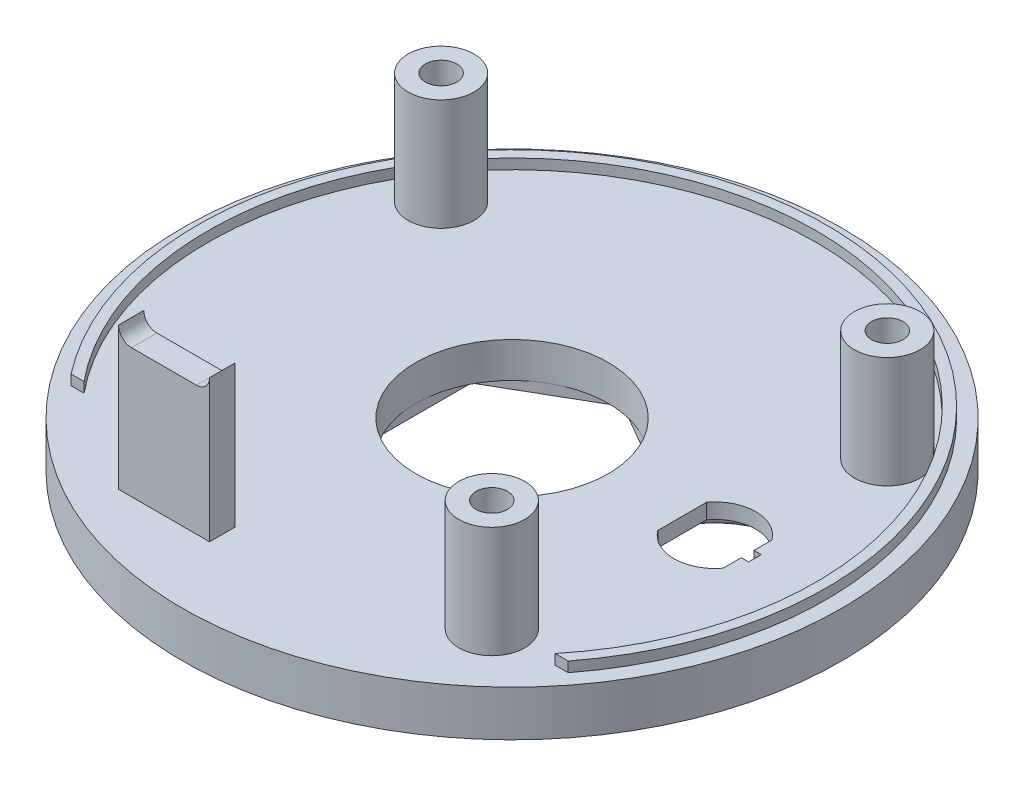
from build123d import *
from build123d.topology import SkipClean

# Parameters (mm, degrees)
SKETCH1_R           = 32.5
BOSS_EXTRUDE1_DEPTH = 21
SHELL1_T            = -2.5
CUT_EXTRUDE2_START  = -18.5
CUT_EXTRUDE2_DEPTH  = 18.5
BOSS_EXTRUDE2_DEPTH = 18.5
SKETCH9_R           = 3.25
BOSS_EXTRUDE3_DEPTH = 10.97
CUT_EXTRUDE4_START  = -18.5
CUT_EXTRUDE4_DEPTH  = 18.5
CUT_EXTRUDE5_DEPTH  = 70.707226983
BOSS_EXTRUDE4_DEPTH = 1
BOSS_EXTRUDE5_START = 2
SKETCH15_R          = 32.5
BOSS_EXTRUDE5_DEPTH = 2
SKETCH13_R          = 9.5
CUT_EXTRUDE6_DEPTH  = 49.052683588
CUT_EXTRUDE7_DEPTH  = 1
SKETCH18_R          = 7.5
CUT_EXTRUDE8_DEPTH  = 3
SKETCH21_R          = 3
CUT_EXTRUDE9_DEPTH  = 3
FILLET1_R           = 0.5
SKETCH23_R          = 1.55
CUT_EXTRUDE10_DEPTH = 49.51154914


with BuildPart() as part:
    # Sketch1 → Boss-Extrude1 (new body)
    with BuildSketch(Plane(origin=(0, 0, 0), x_dir=(1, 0, 0), z_dir=(0, 1, 0))):
        with Locations(Location((0, 0, 0), (0, 0, 90))):
            Circle(SKETCH1_R)
    extrude(amount=BOSS_EXTRUDE1_DEPTH)

    # Shell1
    shell1_openings = [part.faces().sort_by_distance(p)[0] for p in [
        (0, 21, 0),
    ]]
    offset(amount=SHELL1_T, openings=shell1_openings, kind=Kind.INTERSECTION)

    # Sketch4 → Cut-Extrude2 (cut)
    with BuildSketch(Plane(origin=(0, 21, 0), x_dir=(1, 0, 0), z_dir=(0, 1, 0)).offset(CUT_EXTRUDE2_START)):
        with BuildLine():
            Line((-19.2835, -22.981440942), (19.2835, -22.981440942))
            Line((19.2835, -22.981440942), (22.980499826, -22.981440942))
            ThreePointArc((22.980499826, -22.981440942), (0, -32.5), (-22.980499826, -22.981440942))
            Line((-22.980499826, -22.981440942), (-19.2835, -22.981440942))
        make_face()
    extrude(amount=CUT_EXTRUDE2_DEPTH, mode=Mode.SUBTRACT)

    # Sketch5 → Boss-Extrude2 (add, through all)
    with SkipClean():  # the faces are left unmerged after this step: merging them gives an invalid solid
        with BuildSketch(Plane(origin=(0, 2.5, 0), x_dir=(1, 0, 0), z_dir=(0, 1, 0))):
            with BuildLine():
                Line((-22.980499826, -22.981440942), (22.980499826, -22.981440942))
                ThreePointArc((22.980499826, -22.981440942), (21.612881002, -24.27206985), (20.17290677, -25.481440942))
                Line((20.17290677, -25.481440942), (-20.17290677, -25.481440942))
                ThreePointArc((-20.17290677, -25.481440942), (-21.612881002, -24.27206985), (-22.980499826, -22.981440942))
            make_face()
        extrude(amount=BOSS_EXTRUDE2_DEPTH)

    # Sketch9 → Boss-Extrude3 (add)
    with SkipClean():  # the faces are left unmerged after this step: merging them gives an invalid solid
        with BuildSketch(Plane(origin=(0, 2.5, 0), x_dir=(1, 0, 0), z_dir=(0, 1, 0))):
            with Locations(Location((-22, 15, 0), (0, 0, 90))):
                Circle(SKETCH9_R)
            with Locations(Location((22, 15, 0), (0, 0, 90))):
                Circle(SKETCH9_R)
            with Locations(Location((17, -19, 0), (0, 0, 90))):
                Circle(SKETCH9_R)
        extrude(amount=BOSS_EXTRUDE3_DEPTH)

    # Sketch10 → Cut-Extrude4 (cut)
    with BuildSketch(Plane(origin=(0, 21, 0), x_dir=(1, 0, 0), z_dir=(0, 1, 0)).offset(CUT_EXTRUDE4_START)):
        with BuildLine():
            Line((-20.17290677, -25.481440942), (-13.33, -25.481440942))
            Line((-13.33, -25.481440942), (-13.33, -22.981440942))
            Line((-13.33, -22.981440942), (-19.2835, -22.981440942))
            ThreePointArc((-19.2835, -22.981440942), (0, 30), (19.2835, -22.981440942))
            Line((19.2835, -22.981440942), (-4.35, -22.981440942))
            Line((-4.35, -22.981440942), (-4.35, -25.481440942))
            Line((-4.35, -25.481440942), (20.17290677, -25.481440942))
            ThreePointArc((20.17290677, -25.481440942), (0, 32.5), (-20.17290677, -25.481440942))
        make_face()
    extrude(amount=CUT_EXTRUDE4_DEPTH, mode=Mode.SUBTRACT)

    # Sketch11 → Cut-Extrude5 (cut, through all)
    with BuildSketch(Plane.XY.offset(25.481440942)):
        with BuildLine():
            Line((-12.04, 15.23), (-5.64, 15.23))
            ThreePointArc((-5.64, 15.23), (-4.727832252, 15.607832252), (-4.35, 16.52))
            Line((-4.35, 16.52), (-4.35, 21))
            Line((-4.35, 21), (-13.33, 21))
            Line((-13.33, 21), (-13.33, 16.52))
            ThreePointArc((-13.33, 16.52), (-12.952167748, 15.607832252), (-12.04, 15.23))
        make_face()
    extrude(amount=-CUT_EXTRUDE5_DEPTH, mode=Mode.SUBTRACT)

    # Sketch12 → Boss-Extrude4 (add)
    with BuildSketch(Plane(origin=(0, 2.5, 0), x_dir=(1, 0, 0), z_dir=(0, 1, 0))):
        with BuildLine():
            Line((-24.509281911, -18.981440942), (-23.231549664, -18.981440942))
            ThreePointArc((-23.231549664, -18.981440942), (0, 30), (23.231549664, -18.981440942))
            Line((23.231549664, -18.981440942), (24.509281911, -18.981440942))
            ThreePointArc((24.509281911, -18.981440942), (0, 31), (-24.509281911, -18.981440942))
        make_face()
    extrude(amount=BOSS_EXTRUDE4_DEPTH)

    # Sketch15 → Boss-Extrude5 (add)
    with BuildSketch(Plane.XZ.offset(BOSS_EXTRUDE5_START)):
        with Locations(Location((0, 0, 0), (0, 0, 270))):
            Circle(SKETCH15_R)
    extrude(amount=-BOSS_EXTRUDE5_DEPTH)

    # Sketch13 → Cut-Extrude6 (cut, through all)
    with BuildSketch(Plane(origin=(0, 2.5, 0), x_dir=(1, 0, 0), z_dir=(0, 1, 0))):
        with Locations(Location((0, 0, 0), (0, 0, 270))):
            Circle(SKETCH13_R)
        with BuildLine():
            Line((16.775, 2.408318916), (16.775, -2.408318916))
            ThreePointArc((16.775, -2.408318916), (20, -4.025), (23.225, -2.408318916))
            Line((23.225, -2.408318916), (23.225, -0.625))
            Line((23.225, -0.625), (23.95, -0.625))
            Line((23.95, -0.625), (23.95, 0.625))
            Line((23.95, 0.625), (23.225, 0.625))
            Line((23.225, 0.625), (23.225, 2.408318916))
            ThreePointArc((23.225, 2.408318916), (20, 4.025), (16.775, 2.408318916))
        make_face()
    extrude(amount=-CUT_EXTRUDE6_DEPTH, mode=Mode.SUBTRACT)

    # Sketch17 → Cut-Extrude7 (cut)
    with BuildSketch(Plane.XZ.offset(2)):
        Polygon((9.5, -5.484827557), (9.5, 5.484827557), (0, 10.969655115), (-9.5, 5.484827557), (-9.5, -5.484827557), (0, -10.969655115), align=None)
    extrude(amount=-CUT_EXTRUDE7_DEPTH, mode=Mode.SUBTRACT)

    # Sketch18 → Cut-Extrude8 (cut)
    with BuildSketch(Plane.XZ.offset(2)):
        with Locations(Location((20, 0, 0), (0, 0, 270))):
            Circle(SKETCH18_R)
    extrude(amount=-CUT_EXTRUDE8_DEPTH, mode=Mode.SUBTRACT)

    # Sketch21 → Cut-Extrude9 (cut)
    with BuildSketch(Plane.XZ.offset(2)):
        with Locations(Location((-22, -15, 0), (0, 0, 270))):
            Circle(SKETCH21_R)
        with Locations(Location((22, -15, 0), (0, 0, 270))):
            Circle(SKETCH21_R)
        with Locations(Location((17, 19, 0), (0, 0, 270))):
            Circle(SKETCH21_R)
    extrude(amount=-CUT_EXTRUDE9_DEPTH, mode=Mode.SUBTRACT)

    # Fillet1
    fillet1_edges = [part.edges().sort_by_distance(p)[0] for p in [
        (20, -2, 7.5),
        (-22, -2, -12),
        (22, -2, -12),
        (17, -2, 22),
    ]]
    fillet(fillet1_edges, radius=FILLET1_R)

    # Sketch23 → Cut-Extrude10 (cut, through all)
    with BuildSketch(Plane.XZ.offset(-1)):
        with Locations(Location((-22, -15, 0), (0, 0, 270))):
            Circle(SKETCH23_R)
        with Locations(Location((17, 19, 0), (0, 0, 270))):
            Circle(SKETCH23_R)
        with Locations(Location((22, -15, 0), (0, 0, 270))):
            Circle(SKETCH23_R)
    extrude(amount=-CUT_EXTRUDE10_DEPTH, mode=Mode.SUBTRACT)


solid = part.part
